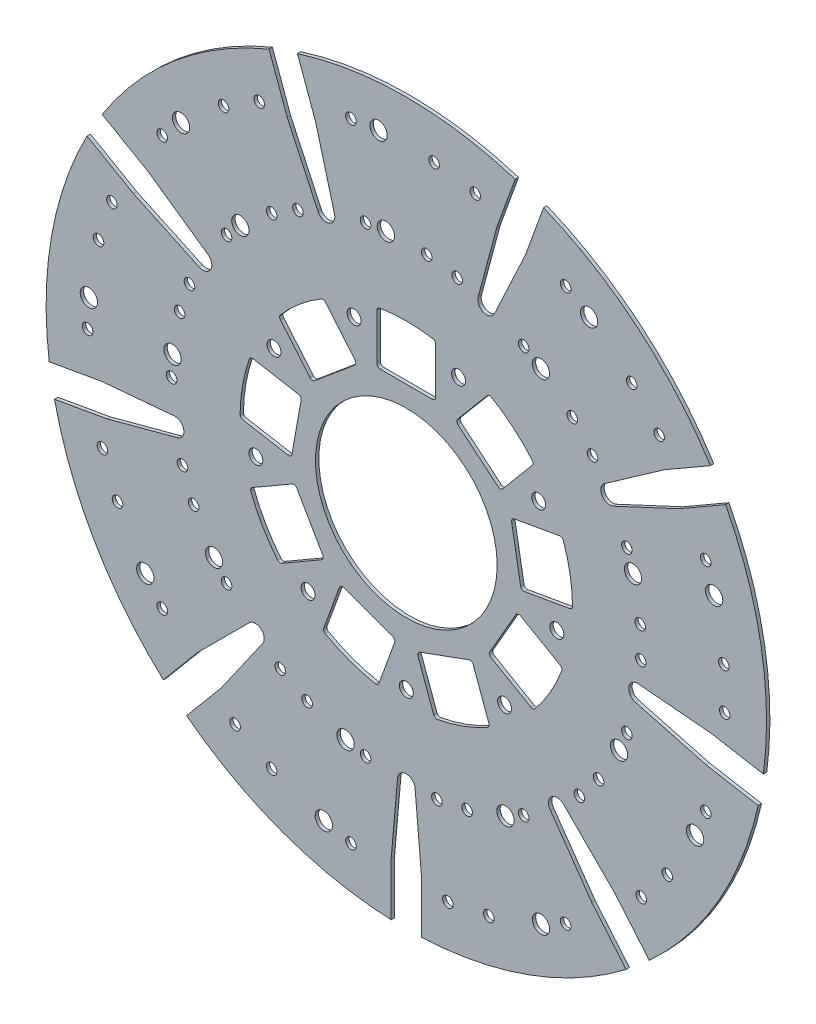
from build123d import *

# Parameters (mm, degrees)
ESBO_O1_R                = 214.5
ESBO_O1_R_2              = 54.1
RESSALTO_EXTRUS_O1_DEPTH = 2
CORTE_EXTRUS_O1_DEPTH    = 2
ESBO_O3_R                = 3.15
ESBO_O3_R_2              = 5.15
CORTE_EXTRUS_O3_DEPTH    = 2
CORTE_EXTRUS_O4_DEPTH    = 2
ESBO_O5_R                = 4.15
CORTE_EXTRUS_O5_DEPTH    = 2
FILETE1_R                = 2
FILETE2_R                = 2
FILETE3_R                = 2
FILETE4_R                = 2


with BuildPart() as part:
    # Esboço1 → Ressalto-extrusão1 (new body)
    with BuildSketch(Plane.XY):
        Circle(ESBO_O1_R)
        Circle(ESBO_O1_R_2, mode=Mode.SUBTRACT)
    extrude(amount=RESSALTO_EXTRUS_O1_DEPTH)

    # Esboço2 → Corte-extrusão1 (cut)
    with BuildSketch(Plane.XY.offset(2)):
        with BuildLine():
            Line((64.925543548, 204.695704446), (81.840010722, 198.539341866))
            Line((81.840010722, 198.539341866), (70.886436876, 168.44464506))
            Line((70.886436876, 168.44464506), (52.695609268, 129.434289367))
            ThreePointArc((52.695609268, 129.434289367), (46.025508646, 126.450838714), (42.833747396, 133.023804577))
            Line((42.833747396, 133.023804577), (53.980898962, 174.625540581))
            Line((53.980898962, 174.625540581), (64.925543548, 204.695704446))
        make_face()
        with BuildLine():
            Line((181.311714425, 115.072671976), (190.311714425, 99.484214708))
            Line((190.311714425, 99.484214708), (162.576291824, 83.471161003))
            Line((162.576291824, 83.471161003), (123.56593613, 65.280333396))
            ThreePointArc((123.56593613, 65.280333396), (116.5386175, 67.282335638), (118.318607546, 74.369144196))
            Line((118.318607546, 74.369144196), (153.598901504, 99.072671976))
            Line((153.598901504, 99.072671976), (181.311714425, 115.072671976))
        make_face()
        with BuildLine():
            Line((212.860119068, -28.394142601), (209.73445187, -46.120682156))
            Line((209.73445187, -46.120682156), (178.194892993, -40.559406966))
            Line((178.194892993, -40.559406966), (136.618388194, -29.419016081))
            ThreePointArc((136.618388194, -29.419016081), (132.522012043, -23.368320044), (138.44087626, -19.083665275))
            Line((138.44087626, -19.083665275), (181.346270971, -22.837400916))
            Line((181.346270971, -22.837400916), (212.860119068, -28.394142601))
        make_face()
        with BuildLine():
            Line((144.808908322, -158.57502229), (131.020108345, -170.145199265))
            Line((131.020108345, -170.145199265), (110.434123316, -145.611777648))
            Line((110.434123316, -145.611777648), (85.745578078, -110.352880978))
            ThreePointArc((85.745578078, -110.352880978), (86.496884333, -103.084679067), (93.785120374, -103.607015672))
            Line((93.785120374, -103.607015672), (124.239704812, -134.06160011))
            Line((124.239704812, -134.06160011), (144.808908322, -158.57502229))
        make_face()
        with BuildLine():
            Line((9, -214.556886684), (-9, -214.556886684))
            Line((-9, -214.556886684), (-9, -182.530779274))
            Line((-9, -182.530779274), (-5.248540977, -139.651406429))
            ThreePointArc((-5.248540977, -139.651406429), (-0.001096862, -134.566571096), (5.246264359, -139.651491973))
            Line((5.246264359, -139.651491973), (9, -182.556886684))
            Line((9, -182.556886684), (9, -214.556886684))
        make_face()
        with BuildLine():
            Line((-131.020108345, -170.145199265), (-144.808908322, -158.57502229))
            Line((-144.808908322, -158.57502229), (-124.222923292, -134.041600674))
            Line((-124.222923292, -134.041600674), (-93.786809378, -103.60548676))
            ThreePointArc((-93.786809378, -103.60548676), (-86.498564823, -103.083268968), (-85.747377055, -110.351483126))
            Line((-85.747377055, -110.351483126), (-110.450904835, -145.631777085))
            Line((-110.450904835, -145.631777085), (-131.020108345, -170.145199265))
        make_face()
        with BuildLine():
            Line((-209.73445187, -46.120682156), (-212.860119068, -28.394142602))
            Line((-212.860119068, -28.394142602), (-181.320560191, -22.832867412))
            Line((-181.320560191, -22.832867412), (-138.441187346, -19.081408389))
            ThreePointArc((-138.441187346, -19.081408389), (-132.522392979, -23.366159648), (-136.618867769, -29.416788904))
            Line((-136.618867769, -29.416788904), (-178.220603773, -40.56394047))
            Line((-178.220603773, -40.56394047), (-209.73445187, -46.120682156))
        make_face()
        with BuildLine():
            Line((-190.311714425, 99.484214708), (-181.311714425, 115.072671976))
            Line((-181.311714425, 115.072671976), (-153.576291824, 99.059618271))
            Line((-153.576291824, 99.059618271), (-118.317395153, 74.371073033))
            ThreePointArc((-118.317395153, 74.371073033), (-116.537520638, 67.284235458), (-123.564871904, 65.282347777))
            Line((-123.564871904, 65.282347777), (-162.598901504, 83.484214708))
            Line((-162.598901504, 83.484214708), (-190.311714425, 99.484214708))
        make_face()
        with BuildLine():
            Line((-81.840010722, 198.539341866), (-64.925543548, 204.695704446))
            Line((-64.925543548, 204.695704446), (-53.971969702, 174.60100764))
            Line((-53.971969702, 174.60100764), (-42.831578817, 133.024502841))
            ThreePointArc((-42.831578817, 133.024502841), (-46.02344722, 126.451589012), (-52.693499205, 129.435148401))
            Line((-52.693499205, 129.435148401), (-70.895366136, 168.469178001))
            Line((-70.895366136, 168.469178001), (-81.840010722, 198.539341866))
        make_face()
    extrude(amount=-CORTE_EXTRUS_O1_DEPTH, mode=Mode.SUBTRACT)

    # Esboço3 → Corte-extrusão3 (cut)
    with BuildSketch(Plane.XY.offset(2)):
        with Locations((-32.949741712, 186.867271134)):
            Circle(ESBO_O3_R)
        with Locations((-24.267332829, 137.626883483)):
            Circle(ESBO_O3_R)
        with Locations((12.180015049, 139.218209058)):
            Circle(ESBO_O3_R)
        with Locations((30.247436048, 136.437366995)):
            Circle(ESBO_O3_R)
        with Locations((41.069416745, 185.252167351)):
            Circle(ESBO_O3_R)
        with Locations((16.537802186, 189.027943963)):
            Circle(ESBO_O3_R)
        with Locations((-16.537802186, 189.027943963)):
            Circle(ESBO_O3_R_2)
        with Locations((-12.180015049, 139.218209058)):
            Circle(ESBO_O3_R_2)
        with Locations((94.875, 164.328320368)):
            Circle(ESBO_O3_R)
        with Locations((69.875, 121.027050179)):
            Circle(ESBO_O3_R)
        with Locations((98.818172671, 98.818172671)):
            Circle(ESBO_O3_R)
        with Locations((110.871129306, 85.074409704)):
            Circle(ESBO_O3_R)
        with Locations((150.53879632, 115.512481154)):
            Circle(ESBO_O3_R)
        with Locations((134.17351173, 134.17351173)):
            Circle(ESBO_O3_R)
        with Locations((108.836128798, 155.434100404)):
            Circle(ESBO_O3_R_2)
        with Locations((80.15730698, 114.476498189)):
            Circle(ESBO_O3_R_2)
        with Locations((178.306674794, 64.898322196)):
            Circle(ESBO_O3_R)
        with Locations((131.322043755, 47.79731503)):
            Circle(ESBO_O3_R)
        with Locations((139.218209058, 12.180015049)):
            Circle(ESBO_O3_R)
        with Locations((139.616988966, -6.095809384)):
            Circle(ESBO_O3_R)
        with Locations((189.569400045, -8.276778753)):
            Circle(ESBO_O3_R)
        with Locations((189.027943963, 16.537802186)):
            Circle(ESBO_O3_R)
        with Locations((183.284425538, 49.110913808)):
            Circle(ESBO_O3_R_2)
        with Locations((134.988134224, 36.169961553)):
            Circle(ESBO_O3_R_2)
        with Locations((178.306674794, -64.898322196)):
            Circle(ESBO_O3_R)
        with Locations((131.322043755, -47.79731503)):
            Circle(ESBO_O3_R)
        with Locations((114.476498189, -80.15730698)):
            Circle(ESBO_O3_R)
        with Locations((103.034507819, -94.413731514)):
            Circle(ESBO_O3_R)
        with Locations((139.89837466, -128.193241895)):
            Circle(ESBO_O3_R)
        with Locations((155.434100404, -108.836128798)):
            Circle(ESBO_O3_R)
        with Locations((171.97190259, -80.191815165)):
            Circle(ESBO_O3_R_2)
        with Locations((126.656513238, -59.060902078)):
            Circle(ESBO_O3_R_2)
        with Locations((94.875, -164.328320368)):
            Circle(ESBO_O3_R)
        with Locations((69.875, -121.027050179)):
            Circle(ESBO_O3_R)
        with Locations((36.169961553, -134.988134224)):
            Circle(ESBO_O3_R)
        with Locations((18.241035363, -138.554419377)):
            Circle(ESBO_O3_R)
        with Locations((24.767344974, -188.126662446)):
            Circle(ESBO_O3_R)
        with Locations((49.110913808, -183.284425538)):
            Circle(ESBO_O3_R)
        with Locations((80.191815165, -171.97190259)):
            Circle(ESBO_O3_R_2)
        with Locations((59.060902078, -126.656513238)):
            Circle(ESBO_O3_R_2)
        with Locations((-32.949741712, -186.867271134)):
            Circle(ESBO_O3_R)
        with Locations((-24.267332829, -137.626883483)):
            Circle(ESBO_O3_R)
        with Locations((-59.060902078, -126.656513238)):
            Circle(ESBO_O3_R)
        with Locations((-75.087620266, -117.863954552)):
            Circle(ESBO_O3_R)
        with Locations((-101.952600684, -160.033526843)):
            Circle(ESBO_O3_R)
        with Locations((-80.191815165, -171.97190259)):
            Circle(ESBO_O3_R)
        with Locations((-49.110913808, -183.284425538)):
            Circle(ESBO_O3_R_2)
        with Locations((-36.169961553, -134.988134224)):
            Circle(ESBO_O3_R_2)
        with Locations((-145.356933082, -121.968948938)):
            Circle(ESBO_O3_R)
        with Locations((-107.054710926, -89.829568454)):
            Circle(ESBO_O3_R)
        with Locations((-126.656513238, -59.060902078)):
            Circle(ESBO_O3_R)
        with Locations((-133.281943867, -42.023635481)):
            Circle(ESBO_O3_R)
        with Locations((-180.967791404, -57.058925456)):
            Circle(ESBO_O3_R)
        with Locations((-171.97190259, -80.191815165)):
            Circle(ESBO_O3_R)
        with Locations((-155.434100404, -108.836128798)):
            Circle(ESBO_O3_R_2)
        with Locations((-114.476498189, -80.15730698)):
            Circle(ESBO_O3_R_2)
        with Locations((-189.75, 0)):
            Circle(ESBO_O3_R)
        with Locations((-139.75, 0)):
            Circle(ESBO_O3_R)
        with Locations((-134.988134224, 36.169961553)):
            Circle(ESBO_O3_R)
        with Locations((-129.112164668, 53.480009673)):
            Circle(ESBO_O3_R)
        with Locations((-175.306141294, 72.614181291)):
            Circle(ESBO_O3_R)
        with Locations((-183.284425538, 49.110913808)):
            Circle(ESBO_O3_R)
        with Locations((-189.027943963, 16.537802186)):
            Circle(ESBO_O3_R_2)
        with Locations((-139.218209058, 12.180015049)):
            Circle(ESBO_O3_R_2)
        with Locations((-145.356933082, 121.968948938)):
            Circle(ESBO_O3_R)
        with Locations((-107.054710926, 89.829568454)):
            Circle(ESBO_O3_R)
        with Locations((-80.15730698, 114.476498189)):
            Circle(ESBO_O3_R)
        with Locations((-64.5293687, 123.959763937)):
            Circle(ESBO_O3_R)
        with Locations((-87.616799361, 168.310305596)):
            Circle(ESBO_O3_R)
        with Locations((-108.836128798, 155.434100404)):
            Circle(ESBO_O3_R)
        with Locations((-134.17351173, 134.17351173)):
            Circle(ESBO_O3_R_2)
        with Locations((-98.818172671, 98.818172671)):
            Circle(ESBO_O3_R_2)
    extrude(amount=-CORTE_EXTRUS_O3_DEPTH, mode=Mode.SUBTRACT)

    # Esboço4 → Corte-extrusão4 (cut)
    with BuildSketch(Plane.XY.offset(2)):
        with BuildLine():
            Line((-17.5, 66.4), (17.5, 66.4))
            Line((17.5, 66.4), (17.5, 97.441007794))
            ThreePointArc((17.5, 97.441007794), (0, 99), (-17.5, 97.441007794))
            Line((-17.5, 97.441007794), (-17.5, 66.4))
        make_face()
        with BuildLine():
            Line((29.275319529, 62.114134193), (56.086875038, 39.616567854))
            Line((56.086875038, 39.616567854), (76.03965024, 63.395359383))
            ThreePointArc((76.03965024, 63.395359383), (63.635973359, 75.838399869), (49.228094731, 85.892925722))
            Line((49.228094731, 85.892925722), (29.275319529, 62.114134193))
        make_face()
        with BuildLine():
            Line((62.352391691, 28.764374675), (68.430077909, -5.703896681))
            Line((68.430077909, -5.703896681), (98.999503047, -0.313682244))
            ThreePointArc((98.999503047, -0.313682244), (97.495967548, 17.191169589), (92.921816828, 34.154589111))
            Line((92.921816828, 34.154589111), (62.352391691, 28.764374675))
        make_face()
        with BuildLine():
            Line((66.254086811, -18.044555434), (48.754086811, -48.355444566))
            Line((48.754086811, -48.355444566), (75.63638812, -63.875948464))
            ThreePointArc((75.63638812, -63.875948464), (85.736514975, -49.5), (93.13638812, -33.565059331))
            Line((93.13638812, -33.565059331), (66.254086811, -18.044555434))
        make_face()
        with BuildLine():
            Line((39.154758381, -56.410237512), (6.265516653, -68.380942528))
            Line((6.265516653, -68.380942528), (16.882166588, -97.549948495))
            ThreePointArc((16.882166588, -97.549948495), (33.859994189, -93.029569458), (49.771408315, -85.579243478))
            Line((49.771408315, -85.579243478), (39.154758381, -56.410237512))
        make_face()
        with BuildLine():
            Line((-6.265516653, -68.380942528), (-39.154758381, -56.410237512))
            Line((-39.154758381, -56.410237512), (-49.771408315, -85.579243478))
            ThreePointArc((-49.771408315, -85.579243478), (-33.859994189, -93.029569458), (-16.882166588, -97.549948495))
            Line((-16.882166588, -97.549948495), (-6.265516653, -68.380942528))
        make_face()
        with BuildLine():
            Line((-48.754086811, -48.355444566), (-66.254086811, -18.044555434))
            Line((-66.254086811, -18.044555434), (-93.13638812, -33.565059331))
            ThreePointArc((-93.13638812, -33.565059331), (-85.736514975, -49.5), (-75.63638812, -63.875948463))
            Line((-75.63638812, -63.875948463), (-48.754086811, -48.355444566))
        make_face()
        with BuildLine():
            Line((-68.430077909, -5.703896681), (-62.352391691, 28.764374675))
            Line((-62.352391691, 28.764374675), (-92.921816828, 34.154589111))
            ThreePointArc((-92.921816828, 34.154589111), (-97.495967548, 17.191169589), (-98.999503046, -0.313682244))
            Line((-98.999503046, -0.313682244), (-68.430077909, -5.703896681))
        make_face()
        with BuildLine():
            Line((-56.086875038, 39.616567854), (-29.275319529, 62.114134193))
            Line((-29.275319529, 62.114134193), (-49.228094731, 85.892925722))
            ThreePointArc((-49.228094731, 85.892925722), (-63.635973359, 75.838399869), (-76.03965024, 63.395359383))
            Line((-76.03965024, 63.395359383), (-56.086875038, 39.616567854))
        make_face()
    extrude(amount=-CORTE_EXTRUS_O4_DEPTH, mode=Mode.SUBTRACT)

    # Esboço5 → Corte-extrusão5 (cut)
    with BuildSketch(Plane.XY.offset(2)):
        with Locations((31.123833043, 85.512028492)):
            Circle(ESBO_O5_R)
        with Locations((78.808311744, 45.5)):
            Circle(ESBO_O5_R)
        with Locations((89.617505524, -15.801984168)):
            Circle(ESBO_O5_R)
        with Locations((58.493672481, -69.710044324)):
            Circle(ESBO_O5_R)
        with Locations((0, -91)):
            Circle(ESBO_O5_R)
        with Locations((-58.493672481, -69.710044324)):
            Circle(ESBO_O5_R)
        with Locations((-89.617505524, -15.801984168)):
            Circle(ESBO_O5_R)
        with Locations((-78.808311744, 45.5)):
            Circle(ESBO_O5_R)
        with Locations((-31.123833043, 85.512028492)):
            Circle(ESBO_O5_R)
    extrude(amount=-CORTE_EXTRUS_O5_DEPTH, mode=Mode.SUBTRACT)

    # Filete1
    filete1_edges = [part.edges().sort_by_distance(p)[0] for p in [
        (-93.13638812, -33.565059331, 1),
        (-98.999503046, -0.313682244, 1),
    ]]
    fillet(filete1_edges, radius=FILETE1_R)

    # Filete2
    filete2_edges = [part.edges().sort_by_distance(p)[0] for p in [
        (-16.882166588, -97.549948495, 1),
        (-75.63638812, -63.875948463, 1),
    ]]
    fillet(filete2_edges, radius=FILETE2_R)

    # Filete3
    filete3_edges = [part.edges().sort_by_distance(p)[0] for p in [
        (17.5, 66.4, 1),
        (56.086875038, 39.616567854, 1),
        (75.63638812, -63.875948464, 1),
        (16.882166588, -97.549948495, 1),
        (-56.086875038, 39.616567854, 1),
    ]]
    fillet(filete3_edges, radius=FILETE3_R)

    # Filete4
    filete4_edges = [part.edges().sort_by_distance(p)[0] for p in [
        (-17.5, 66.4, 1),
        (-17.5, 97.441007794, 1),
        (17.5, 97.441007794, 1),
        (29.275319529, 62.114134193, 1),
        (49.228094731, 85.892925722, 1),
        (76.03965024, 63.395359383, 1),
        (62.352391691, 28.764374675, 1),
        (92.921816828, 34.154589111, 1),
        (98.999503047, -0.313682244, 1),
        (68.430077909, -5.703896681, 1),
        (66.254086811, -18.044555434, 1),
        (93.13638812, -33.565059331, 1),
        (48.754086811, -48.355444566, 1),
        (39.154758381, -56.410237512, 1),
        (49.771408315, -85.579243478, 1),
        (6.265516653, -68.380942528, 1),
        (-6.265516653, -68.380942528, 1),
        (-49.771408315, -85.579243478, 1),
        (-39.154758381, -56.410237512, 1),
        (-48.754086811, -48.355444566, 1),
        (-66.254086811, -18.044555434, 1),
        (-68.430077909, -5.703896681, 1),
        (-92.921816828, 34.154589111, 1),
        (-62.352391691, 28.764374675, 1),
        (-76.03965024, 63.395359383, 1),
        (-49.228094731, 85.892925722, 1),
        (-29.275319529, 62.114134193, 1),
    ]]
    fillet(filete4_edges, radius=FILETE4_R)


solid = part.part
